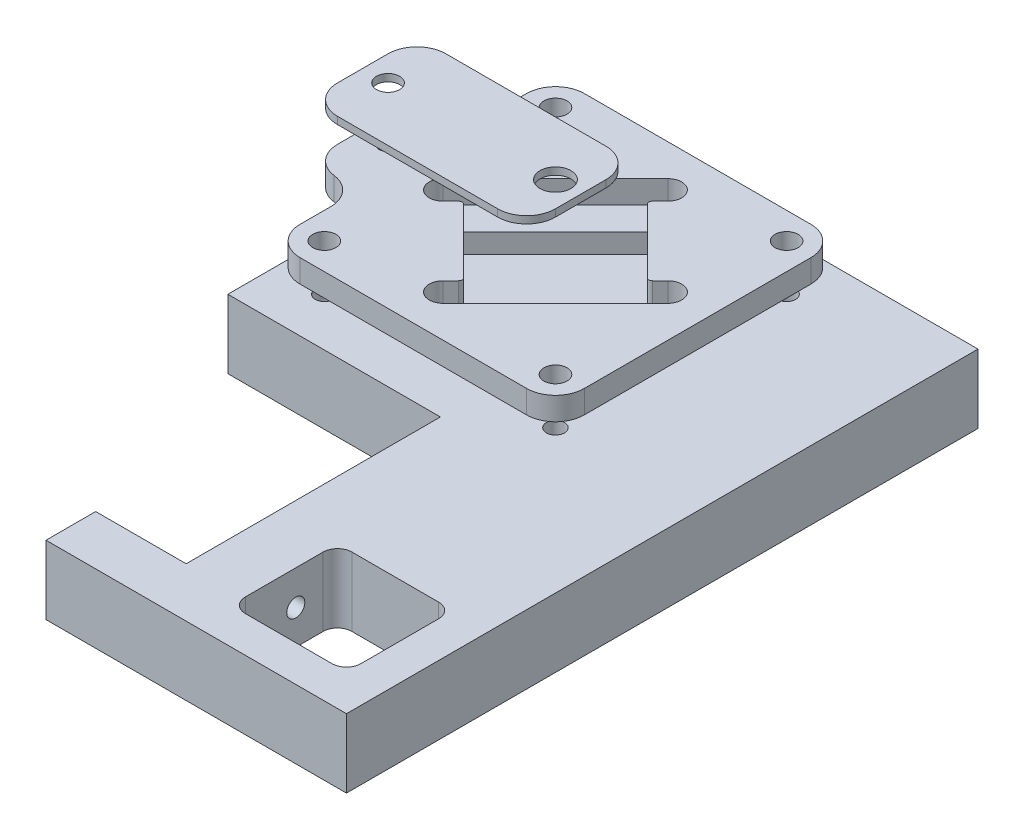
from build123d import *

# Parameters (mm, degrees)
SKETCH3_W                            = 13.49028586
SKETCH3_H                            = 9.525
BOSS_EXTRUDE1_DEPTH                  = 22
SKETCH3_W_2                          = 3
BOSS_EXTRUDE1_2_DEPTH                = 22
BOSS_EXTRUDE1_3_DEPTH                = 22
SKETCH4_W                            = 27.150730292
SKETCH4_H                            = 9.525
BOSS_EXTRUDE2_DEPTH                  = 3
SKETCH5_W                            = 27.150730292
SKETCH5_H                            = 9.525
BOSS_EXTRUDE3_DEPTH                  = 3
SKETCH7_W                            = 16
SKETCH7_H                            = 14.76
BOSS_EXTRUDE4_DEPTH                  = 9.525
SKETCH8_W                            = 9.525
SKETCH8_H                            = 35.2
CUT_EXTRUDE1_DEPTH                   = 9.525
TAP_DRILL_FOR_M3X0_5_TAP1_D          = 2.5
TAP_DRILL_FOR_M3X0_5_TAP1_DEPTH      = 10
TAP_DRILL_FOR_M3X0_5_TAP1_TIP        = 0.751075774
BOSS_EXTRUDE5_DEPTH                  = 9.525
SKETCH15_R                           = 1.915111108
CUT_EXTRUDE4_DEPTH                   = 320.502957772
FILLET4_R                            = 2
SKETCH22_W                           = 39.356349186
SKETCH22_H                           = 39.356349186
BOSS_EXTRUDE7_DEPTH                  = 3.175
FILLET9_R                            = 0.5
M3_CLEARANCE_HOLE1_AT_2_COUNT        = 2
M3_CLEARANCE_HOLE1_AT_2_PITCH        = 32
M3_CLEARANCE_HOLE1_AT_3_COUNT        = 2
M3_CLEARANCE_HOLE1_AT_3_PITCH        = 32
M3_CLEARANCE_HOLE1_AT_4_COUNT        = 2
M3_CLEARANCE_HOLE1_AT_4_PITCH        = 45.254833996
SKETCH27_W                           = 1.25
SKETCH27_H                           = 9.525
TAP_DRILL_FOR_M3X0_5_TAP2_AT_2_COUNT = 2
TAP_DRILL_FOR_M3X0_5_TAP2_AT_2_PITCH = 45.254833996
TAP_DRILL_FOR_M3X0_5_TAP2_AT_3_COUNT = 2
TAP_DRILL_FOR_M3X0_5_TAP2_AT_3_PITCH = 32
TAP_DRILL_FOR_M3X0_5_TAP2_AT_4_COUNT = 2
TAP_DRILL_FOR_M3X0_5_TAP2_AT_4_PITCH = 32
SKETCH28_W                           = 7
SKETCH28_H                           = 15
BOSS_EXTRUDE10_DEPTH                 = 3.175
SKETCH30_W                           = 1.25
SKETCH30_H                           = 3.176
FILLET10_R                           = 4
FILLET11_R                           = 4
SKETCH31_W                           = 30.178174593
SKETCH31_H                           = 15
BOSS_EXTRUDE11_DEPTH                 = 1
SKETCH33_W                           = 1.6
SKETCH33_H                           = 1.001
SKETCH35_W                           = 2.15
SKETCH35_H                           = 23.275
FILLET12_R                           = 4


with BuildPart() as part:
    # Sketch3 → Boss-Extrude1 (new body)
    with BuildSketch(Plane(origin=(-188.9, 0, 188.9), x_dir=(0.7071067811865475, 0, 0.7071067811865477), z_dir=(-0.7071067811865477, 0, 0.7071067811865475))):
        with Locations((0, -11.369469024)):
            Rectangle(SKETCH3_W, SKETCH3_H)
    extrude(amount=-BOSS_EXTRUDE1_DEPTH)



with BuildPart() as body_2:
    # Sketch3 → Boss-Extrude1 2 (new body)
    with BuildSketch(Plane(origin=(-188.9, 0, 188.9), x_dir=(0.7071067811865475, 0, 0.7071067811865477), z_dir=(-0.7071067811865477, 0, 0.7071067811865475))):
        with Locations((12.075365146, -11.369469024)):
            Rectangle(SKETCH3_W_2, SKETCH3_H)
    extrude(amount=-BOSS_EXTRUDE1_2_DEPTH)


with BuildPart() as body_3:
    # Sketch3 → Boss-Extrude1 3 (new body)
    with BuildSketch(Plane(origin=(-188.9, 0, 188.9), x_dir=(0.7071067811865475, 0, 0.7071067811865477), z_dir=(-0.7071067811865477, 0, 0.7071067811865475))):
        with Locations((-12.075365146, -11.369469024)):
            Rectangle(SKETCH3_W_2, SKETCH3_H)
    extrude(amount=-BOSS_EXTRUDE1_3_DEPTH)


with BuildPart() as part_1:
    add(part.part)

    add(body_2.part)  # Boss-Extrude2 merges body 2

    add(body_3.part)  # Boss-Extrude2 merges body 3
    # Sketch4 → Boss-Extrude2 (add)
    with BuildSketch(Plane(origin=(-188.9, 0, 188.9), x_dir=(0.7071067811865472, 0, 0.7071067811865479), z_dir=(-0.7071067811865479, 0, 0.7071067811865472))):
        with Locations((0, -11.369469024)):
            Rectangle(SKETCH4_W, SKETCH4_H)
    extrude(amount=BOSS_EXTRUDE2_DEPTH)

    # Sketch5 → Boss-Extrude3 (add)
    with BuildSketch(Plane(origin=(-173.343650814, 0, 173.343650814), x_dir=(-0.7071067811865472, 0, -0.7071067811865479), z_dir=(0.7071067811865479, 0, -0.7071067811865472))):
        with Locations((0, -11.369469024)):
            Rectangle(SKETCH5_W, SKETCH5_H)
    extrude(amount=BOSS_EXTRUDE3_DEPTH)

    # Sketch7 → Boss-Extrude4 (add)
    with BuildSketch(Plane(origin=(0, -6.606969024, 0), x_dir=(1, 0, 0), z_dir=(0, 1, 0))):
        Polygon((-183.9, -239), (-186.9, -239), (-186.9, -245.88), (-145.3, -245.88), (-145.3, -161.623097719), (-180.821563222, -161.623097719), (-161.623097719, -180.821563222), (-181.422087592, -200.620553095), (-200.620553095, -181.422087592), (-200.620553095, -203.8), (-183.9, -203.8), align=None)
        with Locations((-158.3, -233.5)):
            Rectangle(SKETCH7_W, SKETCH7_H, mode=Mode.SUBTRACT)
    extrude(amount=-BOSS_EXTRUDE4_DEPTH)

    # Sketch8 → Cut-Extrude1 (cut)
    with BuildSketch(Plane(origin=(0, -6.606969024, 0), x_dir=(1, 0, 0), z_dir=(0, 1, 0))):
        with Locations((-179.1375, -221.4)):
            Rectangle(SKETCH8_W, SKETCH8_H)
    extrude(amount=-CUT_EXTRUDE1_DEPTH, mode=Mode.SUBTRACT)

    # Tap Drill for M3x0.5 Tap1
    with Locations(Plane.ZY.offset(174.375)):
        with Locations((211.9, -11.369469024), (231.9, -11.369469024), (221.9, -11.369469024)):
            Hole(TAP_DRILL_FOR_M3X0_5_TAP1_D / 2, depth=TAP_DRILL_FOR_M3X0_5_TAP1_DEPTH)
            with Locations((0, 0, -(TAP_DRILL_FOR_M3X0_5_TAP1_DEPTH + TAP_DRILL_FOR_M3X0_5_TAP1_TIP / 2))):  # 118° drill point
                Cone(0, TAP_DRILL_FOR_M3X0_5_TAP1_D / 2, TAP_DRILL_FOR_M3X0_5_TAP1_TIP, mode=Mode.SUBTRACT)

    # Sketch13 → Boss-Extrude5 (add)
    with BuildSketch(Plane(origin=(0, -6.606969024, 0), x_dir=(1, 0, 0), z_dir=(0, 1, 0))):
        Polygon((-203.8, -203.8), (-200.620553095, -203.8), (-200.620553095, -181.422087592), (-180.821563222, -161.623097719), (-145.3, -161.623097719), (-145.3, -158.443650814), (-203.8, -158.443650814), align=None)
    extrude(amount=-BOSS_EXTRUDE5_DEPTH)

    # Sketch15 → Cut-Extrude4 (cut, through all)
    with BuildSketch(Plane(origin=(0, -6.606969024, 0), x_dir=(1, 0, 0), z_dir=(0, 1, 0))):
        with Locations((-179.467375171, -167.219926457)):
            Circle(SKETCH15_R)
        with Locations((-167.219926457, -179.467375171)):
            Circle(SKETCH15_R)
        with Locations((-195.023724357, -182.776275643)):
            Circle(SKETCH15_R)
        with Locations((-182.776275643, -195.023724357)):
            Circle(SKETCH15_R)
    extrude(amount=-CUT_EXTRUDE4_DEPTH, mode=Mode.SUBTRACT)

    # Fillet4
    fillet4_edges = [part_1.edges().sort_by_distance(p)[0] for p in [
        (-166.3, -11.369469024, 226.12),
        (-150.3, -11.369469024, 226.12),
        (-150.3, -11.369469024, 240.88),
        (-166.3, -11.369469024, 240.88),
    ]]
    fillet(fillet4_edges, radius=FILLET4_R)

    # Sketch27 → Tap Drill for M3x0.5 Tap2 (revolve, cut)
    with BuildSketch(Plane(origin=(-165.121825407, -6.606969024, 165.121825407), x_dir=(0, 0, 1), z_dir=(1, 0, 0))):
        with Locations((0.625, 4.7625)):
            Rectangle(SKETCH27_W, SKETCH27_H)
    tap_drill_for_m3x0_5_tap2 = revolve(axis=Axis((-165.121825407, -0.256969024, 165.121825407), (0, -1, 0)), mode=Mode.SUBTRACT)

    # Tap Drill for M3x0.5 Tap2 at 2: Tap Drill for M3x0.5 Tap2 ×2
    with Locations(*[Vector(-0.7071067811865476, 0, 0.7071067811865476) * (i * TAP_DRILL_FOR_M3X0_5_TAP2_AT_2_PITCH) for i in range(1, TAP_DRILL_FOR_M3X0_5_TAP2_AT_2_COUNT)]):
        add(tap_drill_for_m3x0_5_tap2, mode=Mode.SUBTRACT)

    # Tap Drill for M3x0.5 Tap2 at 3: Tap Drill for M3x0.5 Tap2 ×2
    with Locations(*[(-i * TAP_DRILL_FOR_M3X0_5_TAP2_AT_3_PITCH, 0, 0) for i in range(1, TAP_DRILL_FOR_M3X0_5_TAP2_AT_3_COUNT)]):
        add(tap_drill_for_m3x0_5_tap2, mode=Mode.SUBTRACT)

    # Tap Drill for M3x0.5 Tap2 at 4: Tap Drill for M3x0.5 Tap2 ×2
    with Locations(*[(0, 0, i * TAP_DRILL_FOR_M3X0_5_TAP2_AT_4_PITCH) for i in range(1, TAP_DRILL_FOR_M3X0_5_TAP2_AT_4_COUNT)]):
        add(tap_drill_for_m3x0_5_tap2, mode=Mode.SUBTRACT)


with BuildPart() as body_2_2:
    # Sketch22 → Boss-Extrude7 (new body)
    with BuildSketch(Plane(origin=(0, -3.393030976, 0), x_dir=(1, 0, 0), z_dir=(0, 1, 0))):
        with Locations((-181.121825407, -181.121825407)):
            Rectangle(SKETCH22_W, SKETCH22_H)
        with BuildLine():
            Line((-180.821563222, -165.865738406), (-196.377912408, -181.422087592))
            ThreePointArc((-196.377912408, -181.422087592), (-196.377912408, -184.130463694), (-193.669536306, -184.130463694))
            Line((-193.669536306, -184.130463694), (-192.255322744, -182.716250132))
            Line((-192.255322744, -182.716250132), (-182.716250132, -192.255322744))
            Line((-182.716250132, -192.255322744), (-184.130463694, -193.669536306))
            ThreePointArc((-184.130463694, -193.669536306), (-184.130463694, -196.377912408), (-181.422087592, -196.377912408))
            Line((-181.422087592, -196.377912408), (-165.865738406, -180.821563222))
            ThreePointArc((-165.865738406, -180.821563222), (-165.865738406, -178.11318712), (-168.574114508, -178.11318712))
            Line((-168.574114508, -178.11318712), (-169.98832807, -179.527400682))
            Line((-169.98832807, -179.527400682), (-179.527400682, -169.98832807))
            Line((-179.527400682, -169.98832807), (-178.11318712, -168.574114508))
            ThreePointArc((-178.11318712, -168.574114508), (-178.11318712, -165.865738406), (-180.821563222, -165.865738406))
        make_face(mode=Mode.SUBTRACT)
    extrude(amount=BOSS_EXTRUDE7_DEPTH)

    # Fillet9
    fillet9_edges = [body_2_2.edges().sort_by_distance(p)[0] for p in [
        (-169.98832807, -1.805530976, 179.527400682),
        (-179.527400682, -1.805530976, 169.98832807),
        (-192.255322744, -1.805530976, 182.716250132),
        (-182.716250132, -1.805530976, 192.255322744),
    ]]
    fillet(fillet9_edges, radius=FILLET9_R)

    # Sketch25 → M3 Clearance Hole1 (revolve, cut)
    with BuildSketch(Plane(origin=(-197.121825407, -0.218030976, 197.121825407), x_dir=(0, 0, 1), z_dir=(1, 0, 0))):
        Polygon((0, 0), (0, 4.96137699), (1.6, 4), (1.6, 0), align=None)
    m3_clearance_hole1 = revolve(axis=Axis((-197.121825407, 6.131969024, 197.121825407), (0, -1, 0)), mode=Mode.SUBTRACT)

    # M3 Clearance Hole1 at 2: M3 Clearance Hole1 ×2
    with Locations(*[(0, 0, -i * M3_CLEARANCE_HOLE1_AT_2_PITCH) for i in range(1, M3_CLEARANCE_HOLE1_AT_2_COUNT)]):
        add(m3_clearance_hole1, mode=Mode.SUBTRACT)

    # M3 Clearance Hole1 at 3: M3 Clearance Hole1 ×2
    with Locations(*[(i * M3_CLEARANCE_HOLE1_AT_3_PITCH, 0, 0) for i in range(1, M3_CLEARANCE_HOLE1_AT_3_COUNT)]):
        add(m3_clearance_hole1, mode=Mode.SUBTRACT)

    # M3 Clearance Hole1 at 4: M3 Clearance Hole1 ×2
    with Locations(*[Vector(0.7071067811865475, 0, -0.7071067811865476) * (i * M3_CLEARANCE_HOLE1_AT_4_PITCH) for i in range(1, M3_CLEARANCE_HOLE1_AT_4_COUNT)]):
        add(m3_clearance_hole1, mode=Mode.SUBTRACT)

    # Sketch28 → Boss-Extrude10 (add)
    with BuildSketch(Plane(origin=(0, -0.218030976, 0), x_dir=(1, 0, 0), z_dir=(0, 1, 0))):
        with Locations((-204.3, -181.121825407)):
            Rectangle(SKETCH28_W, SKETCH28_H)
    extrude(amount=-BOSS_EXTRUDE10_DEPTH)

    # Sketch30 → Tap Drill for M3x0.5 Tap5 (revolve, cut)
    with BuildSketch(Plane(origin=(-204.3, -0.218030976, 181.121825407), x_dir=(0, 0, 1), z_dir=(1, 0, 0))):
        with Locations((0.625, 1.588)):
            Rectangle(SKETCH30_W, SKETCH30_H)
    revolve(axis=Axis((-204.3, 6.131969024, 181.121825407), (0, -1, 0)), mode=Mode.SUBTRACT)

    # Fillet10
    fillet10_edges = [body_2_2.edges().sort_by_distance(p)[0] for p in [
        (-207.8, -1.805530976, 188.621825407),
        (-207.8, -1.805530976, 173.621825407),
        (-200.8, -1.805530976, 161.443650814),
        (-161.443650814, -1.805530976, 161.443650814),
        (-161.443650814, -1.805530976, 200.8),
        (-200.8, -1.805530976, 200.8),
    ]]
    fillet(fillet10_edges, radius=FILLET10_R)

    # Fillet11
    fillet11_edges = [body_2_2.edges().sort_by_distance(p)[0] for p in [
        (-200.8, -1.805530976, 173.621825407),
        (-200.8, -1.805530976, 188.621825407),
    ]]
    fillet(fillet11_edges, radius=FILLET11_R)


with BuildPart() as body_3_2:
    # Sketch31 → Boss-Extrude11 (new body)
    with BuildSketch(Plane(origin=(0, 7.143030976, 0), x_dir=(1, 0, 0), z_dir=(0, 1, 0))):
        with Locations((-192.710912704, -181.121825407)):
            Rectangle(SKETCH31_W, SKETCH31_H)
    extrude(amount=-BOSS_EXTRUDE11_DEPTH)

    # Sketch33 → M3 Clearance Hole3 (revolve, cut)
    with BuildSketch(Plane(origin=(-204.3, 7.143030976, 181.121825407), x_dir=(0, 0, 1), z_dir=(1, 0, 0))):
        with Locations((0.8, 0.5005)):
            Rectangle(SKETCH33_W, SKETCH33_H)
    revolve(axis=Axis((-204.3, 13.493030976, 181.121825407), (0, -1, 0)), mode=Mode.SUBTRACT)

    # Sketch35 → M4 Clearance Hole1 (revolve, cut)
    with BuildSketch(Plane(origin=(-181.121825407, 7.143030976, 181.121825407), x_dir=(0, 0, 1), z_dir=(1, 0, 0))):
        with Locations((1.075, 11.6375)):
            Rectangle(SKETCH35_W, SKETCH35_H)
    revolve(axis=Axis((-181.121825407, 13.493030976, 181.121825407), (0, -1, 0)), mode=Mode.SUBTRACT)

    # Fillet12
    fillet12_edges = [body_3_2.edges().sort_by_distance(p)[0] for p in [
        (-207.8, 6.643030976, 173.621825407),
        (-177.621825407, 6.643030976, 173.621825407),
        (-177.621825407, 6.643030976, 188.621825407),
        (-207.8, 6.643030976, 188.621825407),
    ]]
    fillet(fillet12_edges, radius=FILLET12_R)


solid = Compound([part_1.part, body_2_2.part, body_3_2.part])
